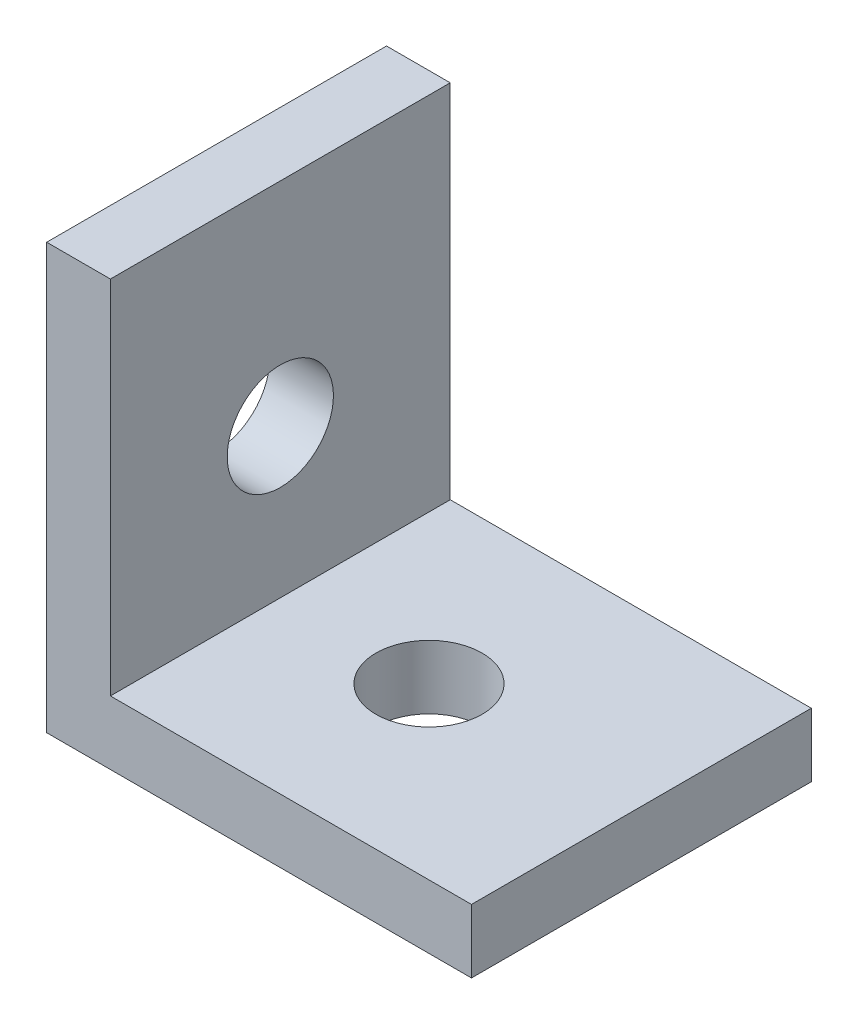
from build123d import *

# Parameters (mm, degrees)
BOSS_EXTRUDE1_DEPTH = 16
CUT_EXTRUDE1_REACH  = 32.741
SKETCH2_R           = 2.5
CUT_EXTRUDE2_REACH  = 32.741
SKETCH3_R           = 2.5


with BuildPart() as part:
    # Sketch1 → Boss-Extrude1 (new body)
    with BuildSketch(Plane.XY):
        Polygon((0, 0), (0, 17), (-3, 17), (-3, -3), (17, -3), (17, 0), align=None)
    extrude(amount=BOSS_EXTRUDE1_DEPTH)

    # Sketch2 → Cut-Extrude1 (cut, up to next)
    with BuildSketch(Plane.ZY.offset(3), mode=Mode.PRIVATE) as cut_extrude1_sk1:
        with Locations(Location((8, 7, 0), (0, 0, 270))):
            Circle(SKETCH2_R)
    cut_extrude1_tool1 = extrude(cut_extrude1_sk1.sketch, amount=-CUT_EXTRUDE1_REACH, mode=Mode.PRIVATE) & part.part
    add(cut_extrude1_tool1.solids().sort_by_distance((-3, 7, 8))[0], mode=Mode.SUBTRACT)

    # Sketch3 → Cut-Extrude2 (cut, up to next)
    with BuildSketch(Plane.XZ.offset(3), mode=Mode.PRIVATE) as cut_extrude2_sk1:
        with Locations((7, 8)):
            Circle(SKETCH3_R)
    cut_extrude2_tool1 = extrude(cut_extrude2_sk1.sketch, amount=-CUT_EXTRUDE2_REACH, mode=Mode.PRIVATE) & part.part
    add(cut_extrude2_tool1.solids().sort_by_distance((7, -3, 8))[0], mode=Mode.SUBTRACT)


solid = part.part
